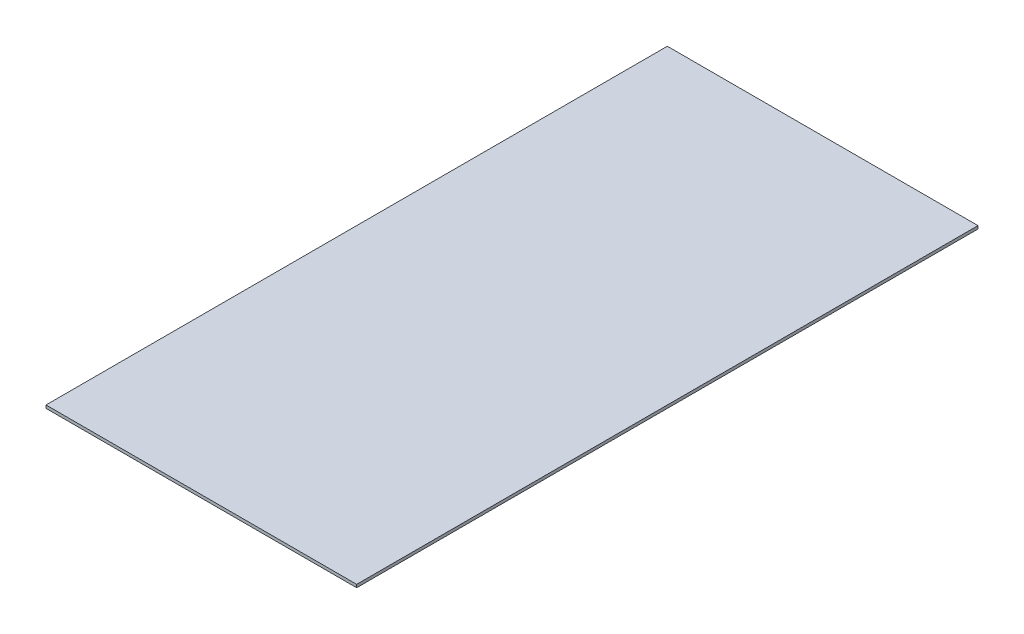
from build123d import *

# Parameters (mm, degrees)
SKETCH1_W           = 304.8
SKETCH1_H           = 609.6
BOSS_EXTRUDE1_DEPTH = 1.4605


with BuildPart() as part:
    # Sketch1 → Boss-Extrude1 (new, symmetric)
    with BuildSketch(Plane(origin=(0, 0, 0), x_dir=(1, 0, 0), z_dir=(0, 1, 0))):
        Rectangle(SKETCH1_W, SKETCH1_H)
    extrude(amount=BOSS_EXTRUDE1_DEPTH, both=True)


solid = part.part
